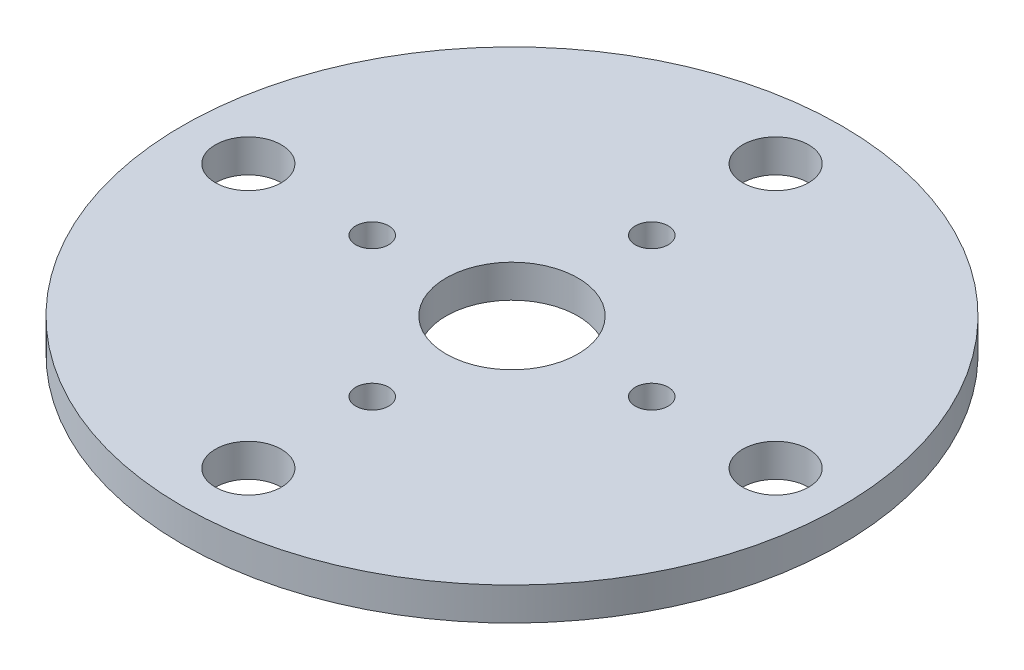
from build123d import *

# Parameters (mm, degrees)
SKETCH1_R           = 10
SKETCH1_R_2         = 2
SKETCH1_R_3         = 1
SKETCH1_R_4         = 0.5
BOSS_EXTRUDE1_DEPTH = 1


with BuildPart() as part:
    # Sketch1 → Boss-Extrude1 (new body)
    with BuildSketch(Plane(origin=(0, 0, 0), x_dir=(1, 0, 0), z_dir=(0, 1, 0))):
        with Locations(Location((0, 0, 0), (0, 0, 270))):
            Circle(SKETCH1_R)
        with Locations(Location((0, 0, 0), (0, 0, 270))):
            Circle(SKETCH1_R_2, mode=Mode.SUBTRACT)
        with Locations(Location((-8, 0, 0), (0, 0, 270))):
            Circle(SKETCH1_R_3, mode=Mode.SUBTRACT)
        with Locations(Location((-4.241002589, 0, 0), (0, 0, 270))):
            Circle(SKETCH1_R_4, mode=Mode.SUBTRACT)
        with Locations(Location((0, -4.241002589, 0), (0, 0, 90))):
            Circle(SKETCH1_R_4, mode=Mode.SUBTRACT)
        with Locations(Location((0, -8, 0), (0, 0, 90))):
            Circle(SKETCH1_R_3, mode=Mode.SUBTRACT)
        with Locations(Location((4.241002589, 0, 0), (0, 0, 90))):
            Circle(SKETCH1_R_4, mode=Mode.SUBTRACT)
        with Locations(Location((8, 0, 0), (0, 0, 90))):
            Circle(SKETCH1_R_3, mode=Mode.SUBTRACT)
        with Locations(Location((0, 4.241002589, 0), (0, 0, 270))):
            Circle(SKETCH1_R_4, mode=Mode.SUBTRACT)
        with Locations(Location((0, 8, 0), (0, 0, 270))):
            Circle(SKETCH1_R_3, mode=Mode.SUBTRACT)
    extrude(amount=BOSS_EXTRUDE1_DEPTH)


solid = part.part
